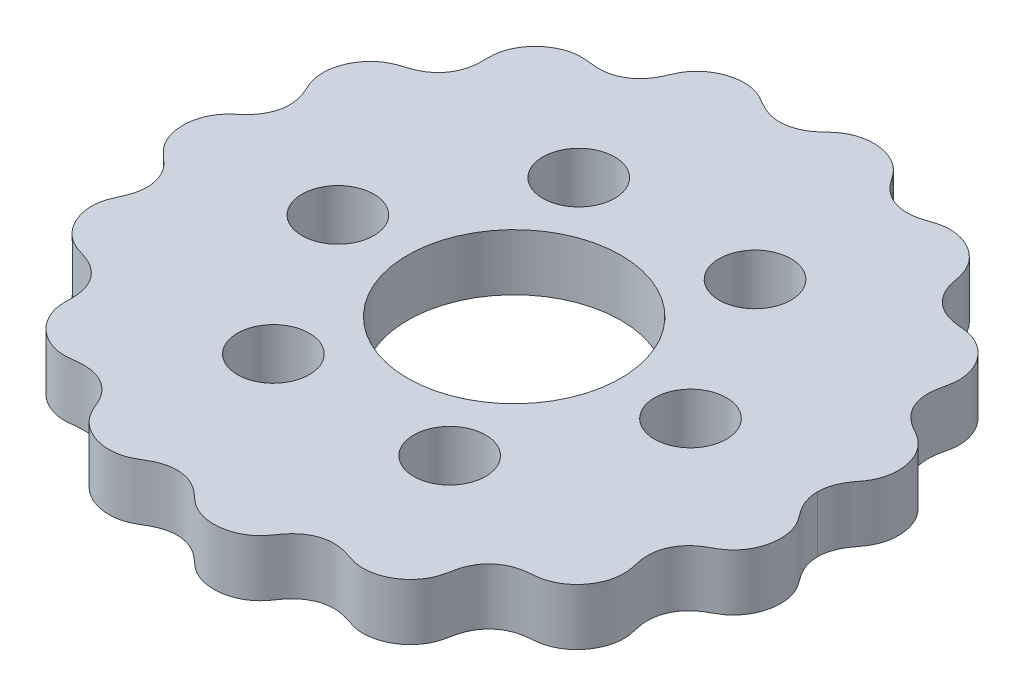
from build123d import *

# Parameters (mm, degrees)
CROQUIS1_R              = 2.55
CROQUIS1_R_2            = 7.56
SALIENTE_EXTRUIR1_DEPTH = 2


with BuildPart() as part:
    # Croquis1 → Saliente-Extruir1 (new, symmetric)
    with BuildSketch(Plane(origin=(0, 0, 0), x_dir=(1, 0, 0), z_dir=(0, 1, 0))):
        with BuildLine():
            add(Edge.make_bspline(
                [(21.5, 6e-09), (21.5, -0.021477729), (21.500593167, -0.064403657), (21.503262416, -0.141588523), (21.510372598, -0.2506358), (21.521018274, -0.353523788), (21.535175808, -0.452206948), (21.557222906, -0.575017626), (21.590559678, -0.722889607), (21.639274228, -0.89252113), (21.707884543, -1.081968972), (21.78873173, -1.26669022), (21.888386964, -1.460455943), (22.008607626, -1.661555772), (22.149838228, -1.868528124), (22.309357779, -2.08239167), (22.468686481, -2.296354295), (22.616280308, -2.518934735), (22.777295322, -2.811357303), (22.950547935, -3.239521206), (23.075522685, -3.817302999), (23.078537532, -4.534680376), (22.911713253, -5.29055349), (22.610017793, -5.937401244), (22.218532391, -6.456743933), (21.777242179, -6.851918436), (21.32091858, -7.125069015), (20.800006514, -7.402592951), (20.275278853, -7.794795833), (19.806259526, -8.344649339), (19.47501305, -9.061365972), (19.359808776, -9.783237796), (19.409811075, -10.452235249), (19.534571948, -10.974738813), (19.622228568, -11.37394657), (19.66331962, -11.780870883), (19.655235202, -12.251048059), (19.539094715, -12.841606723), (19.252298774, -13.507573669), (18.793656717, -14.136374174), (18.262226158, -14.603366893), (17.710139852, -14.916745352), (17.169916613, -15.100032746), (16.669993727, -15.175429226), (16.191607921, -15.20477286), (15.741139447, -15.278537815), (15.326751026, -15.399790896), (14.95430103, -15.566061405), (14.526377994, -15.833151099), (14.082742172, -16.242840318), (13.724187686, -16.776104917), (13.513969977, -17.343953181), (13.412285649, -17.804901498), (13.335129122, -18.208112885), (13.235903541, -18.607442973), (13.024991152, -19.108148448), (12.641574276, -19.662684796), (12.102803702, -20.165182222), (11.412158233, -20.563926571), (10.707597415, -20.779266855), (10.035646399, -20.83404745), (9.496566569, -20.766350177), (9.101123729, -20.652617048), (8.713354253, -20.517830789), (8.26331895, -20.375418), (7.666439408, -20.273547461), (7.02534099, -20.317432866), (6.448722445, -20.496787609), (6.003453554, -20.733835755), (5.673235715, -20.973250267), (5.36103011, -21.271497292), (5.071919671, -21.624726769), (4.807303774, -22.024358247), (4.49206196, -22.419593303), (4.063197476, -22.795814727), (3.515795306, -23.117216867), (2.845595233, -23.344001375), (2.071809167, -23.426718684), (1.351516933, -23.342234872), (0.782242843, -23.147337041), (0.370660406, -22.919550473), (0.094685369, -22.719855646), (-0.112499956, -22.543041557), (-0.361255998, -22.310815393), (-0.709987364, -21.997177169), (-1.207154424, -21.657522052), (-1.890267706, -21.396651069), (-2.676362953, -21.324976244), (-3.387209553, -21.45635226), (-3.989119414, -21.714595034), (-4.490013096, -22.027017012), (-4.95463778, -22.285583422), (-5.517629492, -22.470210474), (-6.162961234, -22.549513553), (-6.874275188, -22.487459807), (-7.611850898, -22.253851381), (-8.232306441, -21.892779921), (-8.718814605, -21.450179098), (-9.074410076, -20.96965434), (-9.30447343, -20.486366652), (-9.527824595, -19.92805394), (-9.870121296, -19.346772049), (-10.386478443, -18.807409124), (-11.094454857, -18.398658751), (-11.819735425, -18.221161807), (-12.49428866, -18.215365114), (-13.089477234, -18.301093687), (-13.623048326, -18.343496822), (-14.21699271, -18.27580449), (-14.843550347, -18.075776473), (-15.466475178, -17.71898194), (-16.037573861, -17.197026852), (-16.446970964, -16.612037769), (-16.700958346, -16.013512551), (-16.822562499, -15.433633895), (-16.830949734, -14.901973921), (-16.810831257, -14.311976259), (-16.888141304, -13.661585672), (-17.129789761, -12.980286404), (-17.584909408, -12.335345436), (-18.152387269, -11.874187352), (-18.695120227, -11.613455805), (-19.141105511, -11.468264348), (-19.466595489, -11.368949051), (-19.72331714, -11.277927034), (-20.034239483, -11.138775287), (-20.437309898, -10.896223894), (-20.890715901, -10.500673536), (-21.32405404, -9.919114011), (-21.639271927, -9.207651873), (-21.778031598, -8.513826596), (-21.773294873, -7.879097024), (-21.662068141, -7.319519537), (-21.477099649, -6.849009046), (-21.21864487, -6.328872243), (-21.001094133, -5.703528424), (-20.921421707, -4.967979091), (-21.045380365, -4.26573249), (-21.28557638, -3.712099987), (-21.5435831, -3.324338564), (-21.759158587, -3.06741441), (-21.974004689, -2.851533582), (-22.177475655, -2.6682982), (-22.384365506, -2.489012482), (-22.584474732, -2.301946971), (-22.769345598, -2.099508481), (-22.935201075, -1.881254997), (-23.0966794, -1.622900682), (-23.24464012, -1.322198439), (-23.343738868, -1.047696955), (-23.406898759, -0.80892307), (-23.441285745, -0.638690065), (-23.458128376, -0.541225552), (-23.475672645, -0.420048085), (-23.491111314, -0.279516), (-23.498128683, -0.126374918), (-23.5, -0.042162775), (-23.5, 0)],
                knots=[0.072614965, 0.072614965, 0.072614965, 0.072614965, 0.072614965, 0.073703014, 0.074791062, 0.075879111, 0.076967159, 0.078055207, 0.079143256, 0.081319353, 0.08349545, 0.085671547, 0.087847644, 0.090023741, 0.092905568, 0.095787396, 0.098669224, 0.101551051, 0.104432879, 0.107314706, 0.113078361, 0.121440052, 0.129801742, 0.13803881, 0.146275878, 0.152004582, 0.157733286, 0.16346199, 0.169190694, 0.177516814, 0.185842935, 0.194348232, 0.20285353, 0.208734111, 0.214614693, 0.217554984, 0.220495275, 0.226375857, 0.234870229, 0.243364601, 0.25155232, 0.259740038, 0.265182119, 0.270624199, 0.27606628, 0.28150836, 0.285899123, 0.290289886, 0.294680648, 0.299071411, 0.307626277, 0.316181144, 0.322095843, 0.325053193, 0.328010542, 0.333925241, 0.33983994, 0.348383698, 0.356927456, 0.365471214, 0.374014972, 0.379929671, 0.38584437, 0.38880172, 0.391759069, 0.397673769, 0.406228635, 0.414783502, 0.419174264, 0.423565027, 0.42795579, 0.432346552, 0.437788633, 0.443230713, 0.448672794, 0.454114874, 0.462302593, 0.470490311, 0.478984683, 0.487479056, 0.493359637, 0.496299928, 0.499240219, 0.50218051, 0.505120801, 0.511001383, 0.51950668, 0.528011978, 0.536338098, 0.544664219, 0.550392923, 0.556121627, 0.561850331, 0.567579035, 0.575816103, 0.58405317, 0.592414861, 0.600776551, 0.606540206, 0.612303862, 0.618067517, 0.623831172, 0.63253556, 0.641239948, 0.649944335, 0.658648723, 0.664412378, 0.670176034, 0.675939689, 0.681703344, 0.690065034, 0.698426725, 0.706663792, 0.71490086, 0.720629564, 0.726358268, 0.732086972, 0.737815676, 0.746141797, 0.754467917, 0.762973215, 0.771478512, 0.777359094, 0.780299385, 0.783239676, 0.786179967, 0.789120258, 0.795000839, 0.803495212, 0.811989584, 0.820177302, 0.828365021, 0.833807101, 0.839249182, 0.844691262, 0.850133343, 0.858914868, 0.867696393, 0.87625126, 0.880528693, 0.884806126, 0.887763476, 0.890720826, 0.893678175, 0.896635525, 0.899592874, 0.902550224, 0.905507573, 0.908464923, 0.912736802, 0.917008681, 0.918076651, 0.91914462, 0.92021259, 0.92128056, 0.923416499, 0.925552439, 0.925552439, 0.925552439, 0.925552439, 0.925552439], degree=4))
            add(Edge.make_bspline(
                [(21.5, 6e-09), (21.5, 0.021477735), (21.500593167, 0.064403663), (21.503262416, 0.141588528), (21.510372598, 0.250635805), (21.521018274, 0.353523794), (21.535175808, 0.452206954), (21.557222906, 0.575017631), (21.590559678, 0.722889613), (21.639274228, 0.892521136), (21.707884543, 1.081968978), (21.788731729, 1.266690226), (21.888386964, 1.460455948), (22.008607626, 1.661555778), (22.149838228, 1.86852813), (22.309357779, 2.082391676), (22.468686481, 2.296354301), (22.616280308, 2.518934741), (22.777295322, 2.811357309), (22.950547935, 3.239521212), (23.075522685, 3.817303005), (23.078537532, 4.534680382), (22.911713252, 5.290553496), (22.610017792, 5.937401249), (22.21853239, 6.456743939), (21.777242178, 6.851918442), (21.320918579, 7.12506902), (20.800006513, 7.402592956), (20.275278852, 7.794795839), (19.806259525, 8.344649344), (19.475013049, 9.061365977), (19.359808775, 9.783237801), (19.409811074, 10.452235255), (19.534571947, 10.974738818), (19.622228566, 11.373946575), (19.663319619, 11.780870889), (19.655235201, 12.251048065), (19.539094713, 12.841606729), (19.252298772, 13.507573674), (18.793656715, 14.136374179), (18.262226156, 14.603366898), (17.71013985, 14.916745357), (17.16991661, 15.100032751), (16.669993725, 15.175429231), (16.191607919, 15.204772865), (15.741139445, 15.27853782), (15.326751024, 15.399790901), (14.954301028, 15.566061409), (14.526377991, 15.833151104), (14.082742169, 16.242840322), (13.724187683, 16.776104921), (13.513969975, 17.343953186), (13.412285647, 17.804901503), (13.33512912, 18.20811289), (13.235903538, 18.607442978), (13.024991149, 19.108148453), (12.641574273, 19.6626848), (12.102803699, 20.165182226), (11.41215823, 20.563926576), (10.707597412, 20.77926686), (10.035646396, 20.834047454), (9.496566566, 20.766350181), (9.101123726, 20.652617052), (8.71335425, 20.517830793), (8.263318947, 20.375418004), (7.666439405, 20.273547465), (7.025340987, 20.317432869), (6.448722442, 20.496787613), (6.003453551, 20.733835759), (5.673235712, 20.97325027), (5.361030107, 21.271497296), (5.071919668, 21.624726772), (4.807303771, 22.02435825), (4.492061957, 22.419593306), (4.063197472, 22.79581473), (3.515795302, 23.11721687), (2.845595229, 23.344001378), (2.071809163, 23.426718687), (1.35151693, 23.342234874), (0.782242839, 23.147337044), (0.370660402, 22.919550475), (0.094685366, 22.719855649), (-0.112499959, 22.543041559), (-0.361256001, 22.310815396), (-0.709987367, 21.997177172), (-1.207154427, 21.657522054), (-1.890267709, 21.396651071), (-2.676362956, 21.324976246), (-3.387209556, 21.456352263), (-3.989119417, 21.714595036), (-4.490013099, 22.027017014), (-4.954637783, 22.285583424), (-5.517629495, 22.470210476), (-6.162961237, 22.549513555), (-6.874275191, 22.487459809), (-7.611850901, 22.253851383), (-8.232306444, 21.892779922), (-8.718814608, 21.450179099), (-9.074410079, 20.969654341), (-9.304473433, 20.486366653), (-9.527824597, 19.928053942), (-9.870121299, 19.34677205), (-10.386478445, 18.807409125), (-11.094454859, 18.398658752), (-11.819735428, 18.221161808), (-12.494288663, 18.215365115), (-13.089477237, 18.301093688), (-13.623048329, 18.343496823), (-14.216992712, 18.275804491), (-14.843550349, 18.075776474), (-15.466475181, 17.718981941), (-16.037573864, 17.197026853), (-16.446970966, 16.61203777), (-16.700958348, 16.013512551), (-16.822562501, 15.433633895), (-16.830949736, 14.901973921), (-16.810831259, 14.311976259), (-16.888141306, 13.661585672), (-17.129789762, 12.980286404), (-17.584909409, 12.335345436), (-18.152387271, 11.874187352), (-18.695120229, 11.613455805), (-19.141105513, 11.468264347), (-19.46659549, 11.368949051), (-19.723317141, 11.277927034), (-20.034239484, 11.138775286), (-20.4373099, 10.896223893), (-20.890715903, 10.500673536), (-21.324054042, 9.919114011), (-21.639271928, 9.207651873), (-21.778031599, 8.513826596), (-21.773294874, 7.879097023), (-21.662068142, 7.319519537), (-21.47709965, 6.849009045), (-21.218644871, 6.328872242), (-21.001094134, 5.703528423), (-20.921421708, 4.967979091), (-21.045380365, 4.26573249), (-21.28557638, 3.712099986), (-21.5435831, 3.324338564), (-21.759158587, 3.06741441), (-21.974004689, 2.851533582), (-22.177475655, 2.668298199), (-22.384365506, 2.489012482), (-22.584474732, 2.30194697), (-22.769345598, 2.09950848), (-22.935201076, 1.881254996), (-23.0966794, 1.622900681), (-23.24464012, 1.322198438), (-23.343738868, 1.047696955), (-23.406898759, 0.808923069), (-23.441285746, 0.638690065), (-23.458128376, 0.541225551), (-23.475672645, 0.420048084), (-23.491111314, 0.279515999), (-23.498128683, 0.126374917), (-23.5, 0.042162774), (-23.5, 0)],
                knots=[0.072614965, 0.072614965, 0.072614965, 0.072614965, 0.072614965, 0.073703014, 0.074791062, 0.075879111, 0.076967159, 0.078055207, 0.079143256, 0.081319353, 0.08349545, 0.085671547, 0.087847644, 0.090023741, 0.092905568, 0.095787396, 0.098669224, 0.101551051, 0.104432879, 0.107314706, 0.113078361, 0.121440052, 0.129801742, 0.13803881, 0.146275878, 0.152004582, 0.157733286, 0.16346199, 0.169190694, 0.177516814, 0.185842935, 0.194348232, 0.20285353, 0.208734111, 0.214614693, 0.217554984, 0.220495275, 0.226375857, 0.234870229, 0.243364601, 0.25155232, 0.259740038, 0.265182119, 0.270624199, 0.27606628, 0.28150836, 0.285899123, 0.290289886, 0.294680648, 0.299071411, 0.307626277, 0.316181144, 0.322095843, 0.325053193, 0.328010542, 0.333925241, 0.33983994, 0.348383698, 0.356927456, 0.365471214, 0.374014972, 0.379929671, 0.38584437, 0.38880172, 0.391759069, 0.397673769, 0.406228635, 0.414783502, 0.419174264, 0.423565027, 0.42795579, 0.432346552, 0.437788633, 0.443230713, 0.448672794, 0.454114874, 0.462302593, 0.470490311, 0.478984683, 0.487479056, 0.493359637, 0.496299928, 0.499240219, 0.50218051, 0.505120801, 0.511001383, 0.51950668, 0.528011978, 0.536338098, 0.544664219, 0.550392923, 0.556121627, 0.561850331, 0.567579035, 0.575816103, 0.58405317, 0.592414861, 0.600776551, 0.606540206, 0.612303862, 0.618067517, 0.623831172, 0.63253556, 0.641239948, 0.649944335, 0.658648723, 0.664412378, 0.670176034, 0.675939689, 0.681703344, 0.690065034, 0.698426725, 0.706663792, 0.71490086, 0.720629564, 0.726358268, 0.732086972, 0.737815676, 0.746141797, 0.754467917, 0.762973215, 0.771478512, 0.777359094, 0.780299385, 0.783239676, 0.786179967, 0.789120258, 0.795000839, 0.803495212, 0.811989584, 0.820177302, 0.828365021, 0.833807101, 0.839249182, 0.844691262, 0.850133343, 0.858914868, 0.867696393, 0.87625126, 0.880528693, 0.884806126, 0.887763476, 0.890720826, 0.893678175, 0.896635525, 0.899592874, 0.902550224, 0.905507573, 0.908464923, 0.912736802, 0.917008681, 0.918076651, 0.91914462, 0.92021259, 0.92128056, 0.923416499, 0.925552439, 0.925552439, 0.925552439, 0.925552439, 0.925552439], degree=4))
        make_face()
        with Locations(Location((12.5, 0, 0), (0, 0, 270))):
            Circle(CROQUIS1_R, mode=Mode.SUBTRACT)
        with Locations(Location((6.25, -10.825317547, 0), (0, 0, 270))):
            Circle(CROQUIS1_R, mode=Mode.SUBTRACT)
        with Locations(Location((-6.25, -10.825317547, 0), (0, 0, 270))):
            Circle(CROQUIS1_R, mode=Mode.SUBTRACT)
        with Locations(Location((-12.5, 0, 0), (0, 0, 270))):
            Circle(CROQUIS1_R, mode=Mode.SUBTRACT)
        with Locations(Location((-6.25, 10.825317547, 0), (0, 0, 270))):
            Circle(CROQUIS1_R, mode=Mode.SUBTRACT)
        with Locations(Location((6.25, 10.825317547, 0), (0, 0, 270))):
            Circle(CROQUIS1_R, mode=Mode.SUBTRACT)
        with Locations(Location((0, 0, 0), (0, 0, 270))):
            Circle(CROQUIS1_R_2, mode=Mode.SUBTRACT)
    extrude(amount=SALIENTE_EXTRUIR1_DEPTH, both=True)


solid = part.part
